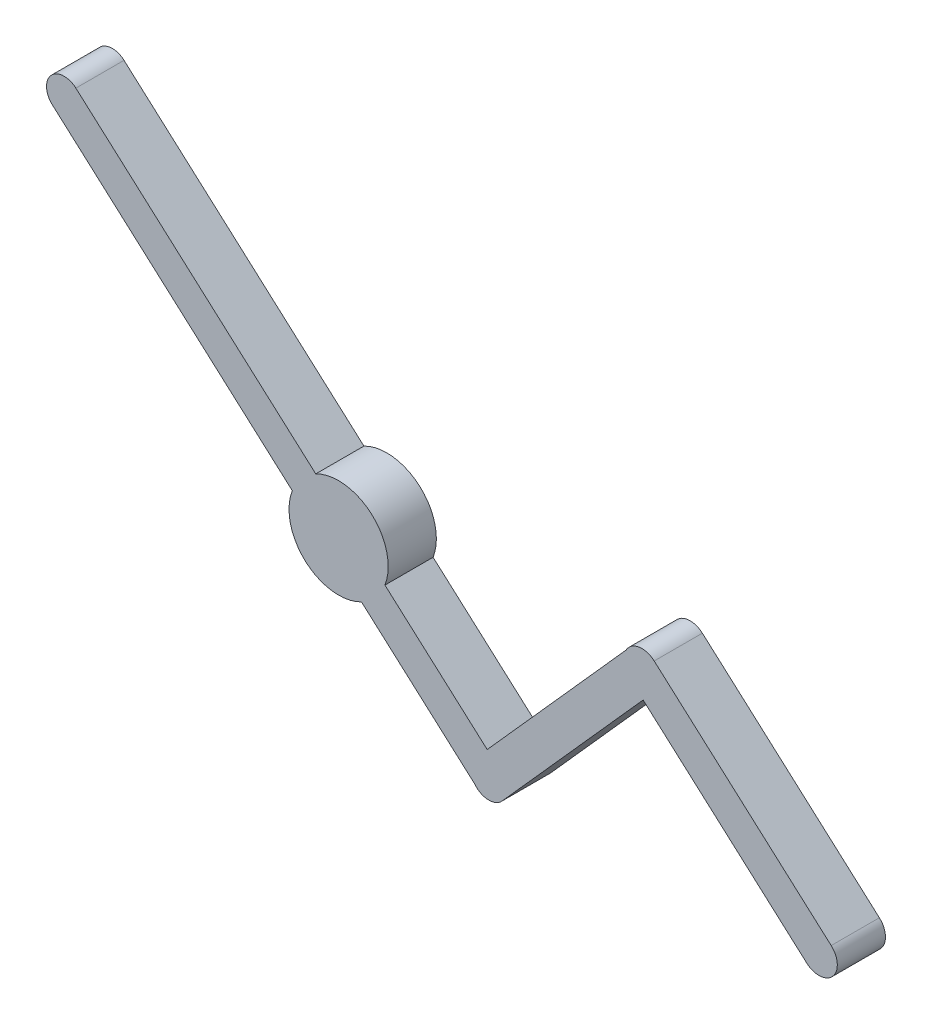
from build123d import *

# Parameters (mm, degrees)
SKETCH_1_R      = 2.059190546
EXTRUDE_1_DEPTH = 2


with BuildPart() as part:
    # 草图1 → 凸台-拉伸1 (new body)
    with BuildSketch(Plane.XY):
        with Locations((190.281006736, -63.323217884)):
            Circle(SKETCH_1_R)
        with BuildLine():
            Line((179.370166114, -52.605112551), (197.006135651, -68.344908874))
            ThreePointArc((197.006135651, -68.344908874), (197.064808236, -69.37764283), (196.03207428, -69.436315415))
            Line((196.03207428, -69.436315415), (178.396104743, -53.696519092))
            ThreePointArc((178.396104743, -53.696519092), (178.337432158, -52.663785136), (179.370166114, -52.605112551))
        make_face()
        with BuildLine():
            Line((195.963935947, -68.395133444), (202.322819853, -61.270194814))
            ThreePointArc((202.322819853, -61.270194814), (203.373467572, -61.210504496), (203.433157889, -62.261152215))
            Line((203.433157889, -62.261152215), (197.074273983, -69.386090845))
            ThreePointArc((197.074273983, -69.386090845), (196.023626265, -69.445781162), (195.963935947, -68.395133444))
        make_face()
        with BuildLine():
            Line((203.385396717, -61.197138247), (210.734761982, -67.756319025))
            ThreePointArc((210.734761982, -67.756319025), (210.795889404, -68.832262137), (209.719946291, -68.893389559))
            Line((209.719946291, -68.893389559), (202.370581025, -62.334208781))
            ThreePointArc((202.370581025, -62.334208781), (202.309453604, -61.258265669), (203.385396717, -61.197138247))
        make_face()
    extrude(amount=EXTRUDE_1_DEPTH)


solid = part.part
